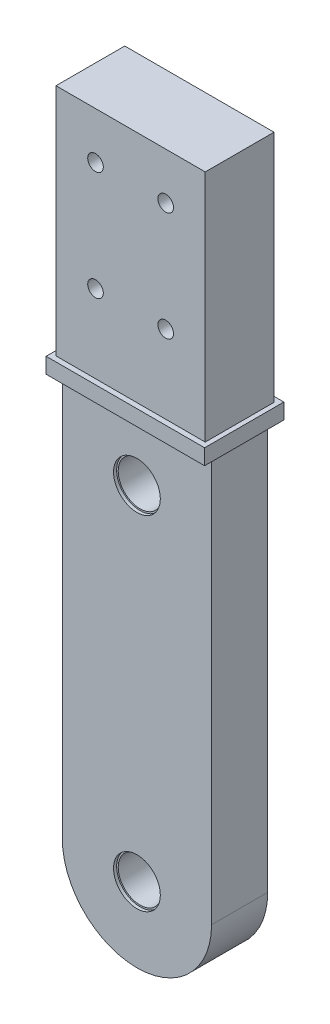
from build123d import *

# Parameters (mm, degrees)
SKETCH1_R           = 7
SKETCH1_R_2         = 2.5
BOSS_EXTRUDE1_DEPTH = 9
SKETCH3_W           = 47.85
SKETCH3_H           = 65
SKETCH3_R           = 2.5
BOSS_EXTRUDE2_DEPTH = 11.025
SKETCH4_R           = 7.5
CUT_EXTRUDE1_DEPTH  = 1
CUT_EXTRUDE2_START  = -1
SKETCH5_R           = 7.5
CUT_EXTRUDE2_DEPTH  = 1
SKETCH6_R           = 7.5
CUT_EXTRUDE3_DEPTH  = 1
CUT_EXTRUDE4_START  = -1
SKETCH7_R           = 7.5
CUT_EXTRUDE4_DEPTH  = 1
BOSS_EXTRUDE3_START = 10
SKETCH8_W           = 50.8
SKETCH8_H           = 25.4
BOSS_EXTRUDE3_DEPTH = 5
SKETCH9_W           = 47.85
SKETCH9_H           = 22.05
BOSS_EXTRUDE4_DEPTH = 10


with BuildPart() as part:
    # Sketch1 → Boss-Extrude1 (new, symmetric)
    with BuildSketch(Plane.XY):
        with BuildLine():
            Line((-23.925, 0), (-23.925, 100))
            Line((-23.925, 100), (23.925, 100))
            Line((23.925, 100), (23.925, 0))
            Line((23.925, 0), (23.925, -110))
            ThreePointArc((23.925, -110), (16.91752974, -126.91752974), (0, -133.925))
            ThreePointArc((0, -133.925), (-16.91752974, -126.91752974), (-23.925, -110))
            Line((-23.925, -110), (-23.925, 0))
        make_face()
        Circle(SKETCH1_R, mode=Mode.SUBTRACT)
        with Locations((-11.25, 85)):
            Circle(SKETCH1_R_2, mode=Mode.SUBTRACT)
        with Locations((11.25, 85)):
            Circle(SKETCH1_R_2, mode=Mode.SUBTRACT)
        with Locations((11.25, 50)):
            Circle(SKETCH1_R_2, mode=Mode.SUBTRACT)
        with Locations((-11.25, 50)):
            Circle(SKETCH1_R_2, mode=Mode.SUBTRACT)
        with Locations((0, -110)):
            Circle(SKETCH1_R, mode=Mode.SUBTRACT)
    extrude(amount=BOSS_EXTRUDE1_DEPTH, both=True)

    # Sketch3 → Boss-Extrude2 (add, symmetric)
    with BuildSketch(Plane.XY):
        with Locations((0, 67.5)):
            Rectangle(SKETCH3_W, SKETCH3_H)
        with Locations((-11.25, 50)):
            Circle(SKETCH3_R, mode=Mode.SUBTRACT)
        with Locations((11.25, 50)):
            Circle(SKETCH3_R, mode=Mode.SUBTRACT)
        with Locations((11.25, 85)):
            Circle(SKETCH3_R, mode=Mode.SUBTRACT)
        with Locations((-11.25, 85)):
            Circle(SKETCH3_R, mode=Mode.SUBTRACT)
    extrude(amount=BOSS_EXTRUDE2_DEPTH, both=True)

    # Sketch4 → Cut-Extrude1 (cut)
    with BuildSketch(Plane.XY.offset(9)):
        with Locations((0, -110)):
            Circle(SKETCH4_R)
    extrude(amount=-CUT_EXTRUDE1_DEPTH, mode=Mode.SUBTRACT)

    # Sketch5 → Cut-Extrude2 (cut)
    with BuildSketch(Plane(origin=(0, 0, -9), x_dir=(-1, 0, 0), z_dir=(0, 0, -1)).offset(CUT_EXTRUDE2_START)):
        with Locations(Location((0, -110, 0), (0, 0, 180))):
            Circle(SKETCH5_R)
    extrude(amount=CUT_EXTRUDE2_DEPTH, mode=Mode.SUBTRACT)

    # Sketch6 → Cut-Extrude3 (cut)
    with BuildSketch(Plane.XY.offset(9)):
        Circle(SKETCH6_R)
    extrude(amount=-CUT_EXTRUDE3_DEPTH, mode=Mode.SUBTRACT)

    # Sketch7 → Cut-Extrude4 (cut)
    with BuildSketch(Plane(origin=(0, 0, -9), x_dir=(-1, 0, 0), z_dir=(0, 0, -1)).offset(CUT_EXTRUDE4_START)):
        with Locations(Location((0, 0, 0), (0, 0, 180))):
            Circle(SKETCH7_R)
    extrude(amount=CUT_EXTRUDE4_DEPTH, mode=Mode.SUBTRACT)

    # Sketch8 → Boss-Extrude3 (add)
    with BuildSketch(Plane.XZ.offset(-35).offset(BOSS_EXTRUDE3_START)):
        Rectangle(SKETCH8_W, SKETCH8_H)
    extrude(amount=BOSS_EXTRUDE3_DEPTH)

    # Sketch9 → Boss-Extrude4 (add)
    with BuildSketch(Plane.XZ.offset(-35)):
        Rectangle(SKETCH9_W, SKETCH9_H)
    extrude(amount=BOSS_EXTRUDE4_DEPTH)


solid = part.part
